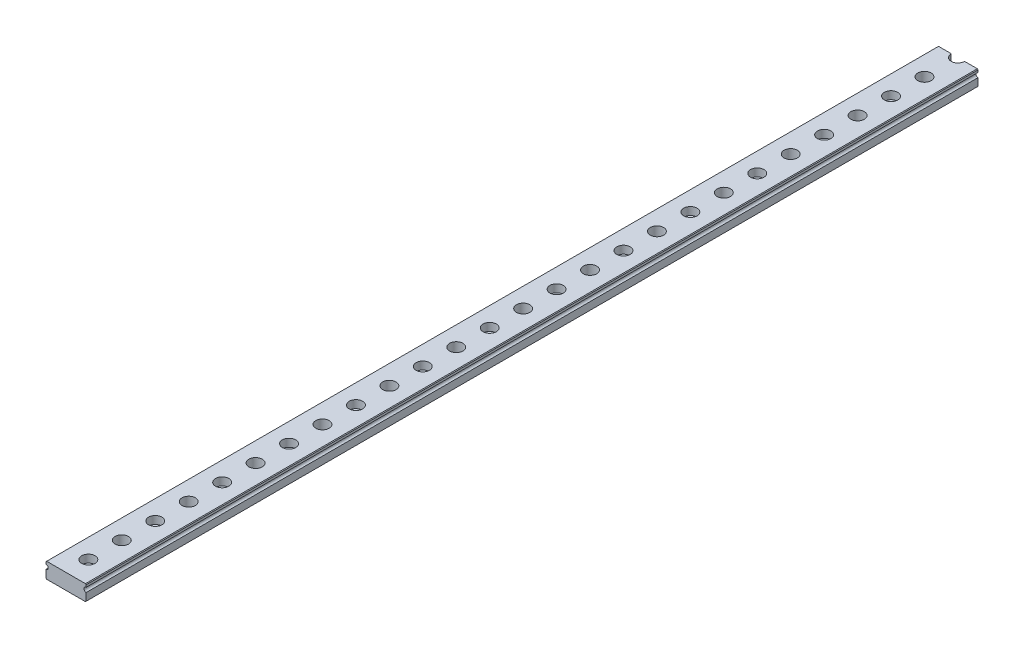
from build123d import *

# Parameters (mm, degrees)
ESBO_O1_W                                            = 18
ESBO_O1_H                                            = 400
RESSALTO_EXTRUS_O1_DEPTH                             = 7
FURO_DE_DI_METRO_2_0_2_1_D                           = 2
FURO_DE_DI_METRO_6_0_6_1_D                           = 6
REBAIXO_PARA_PARAFUSO_DE_M_QUINA_DE_CABE_D           = 3.5
REBAIXO_PARA_PARAFUSO_DE_M_QUINA_DE_CABE_CBORE_D     = 6
REBAIXO_PARA_PARAFUSO_DE_M_QUINA_DE_CABE_CBORE_DEPTH = 3.5
PADR_O_LINEAR1_COUNT                                 = 13
PADR_O_LINEAR1_PITCH                                 = 30
PADR_O_LINEAR2_COUNT                                 = 14
PADR_O_LINEAR2_PITCH                                 = 30
CHANFRO1_SIZE                                        = 0.3


with BuildPart() as part:
    # Esboço1 → Ressalto-extrusão1 (new body)
    with BuildSketch(Plane.XZ):
        with Locations((-9, -200)):
            Rectangle(ESBO_O1_W, ESBO_O1_H)
    extrude(amount=-RESSALTO_EXTRUS_O1_DEPTH)

    # Furo de diâmetro Ø2.0 (2)1 (through all)
    with Locations(Plane(origin=(0, 0, -400), x_dir=(-1, 0, 0), z_dir=(0, 0, -1))):
        with Locations((0, 4.7), (18, 4.7)):
            Hole(FURO_DE_DI_METRO_2_0_2_1_D / 2)

    # Furo de diâmetro Ø6.0 (6)1 (through all)
    with Locations(Plane(origin=(0, 7, 0), x_dir=(1, 0, 0), z_dir=(0, 1, 0))):
        with Locations((-9, 25)):
            furo_de_di_metro_6_0_6_1 = Hole(FURO_DE_DI_METRO_6_0_6_1_D / 2)

    # Rebaixo para parafuso de máquina de cabeça sextavada de M31 (through all)
    with Locations(Plane(origin=(0, 7, 0), x_dir=(1, 0, 0), z_dir=(0, 1, 0))):
        with Locations((-9, 10)):
            rebaixo_para_parafuso_de_m_quina_de_cabe = CounterBoreHole(REBAIXO_PARA_PARAFUSO_DE_M_QUINA_DE_CABE_D / 2, REBAIXO_PARA_PARAFUSO_DE_M_QUINA_DE_CABE_CBORE_D / 2, REBAIXO_PARA_PARAFUSO_DE_M_QUINA_DE_CABE_CBORE_DEPTH)

    # Padrão linear1: Furo de diâmetro Ø6.0 (6)1 ×13
    with Locations(*[(0, 0, -i * PADR_O_LINEAR1_PITCH) for i in range(1, PADR_O_LINEAR1_COUNT)]):
        add(furo_de_di_metro_6_0_6_1, mode=Mode.SUBTRACT)

    # Padrão linear2: Rebaixo para parafuso de máquina de cabeça sextavada de M31 ×14
    with Locations(*[(0, 0, -i * PADR_O_LINEAR2_PITCH) for i in range(1, PADR_O_LINEAR2_COUNT)]):
        add(rebaixo_para_parafuso_de_m_quina_de_cabe, mode=Mode.SUBTRACT)

    # Chanfro1
    chanfro1_edges = [part.edges().sort_by_distance(p)[0] for p in [
        (0, 7, -200),
        (-18, 7, -200),
        (0, 0, -200),
        (-18, 0, -200),
    ]]
    chamfer(chanfro1_edges, length=CHANFRO1_SIZE)


solid = part.part
